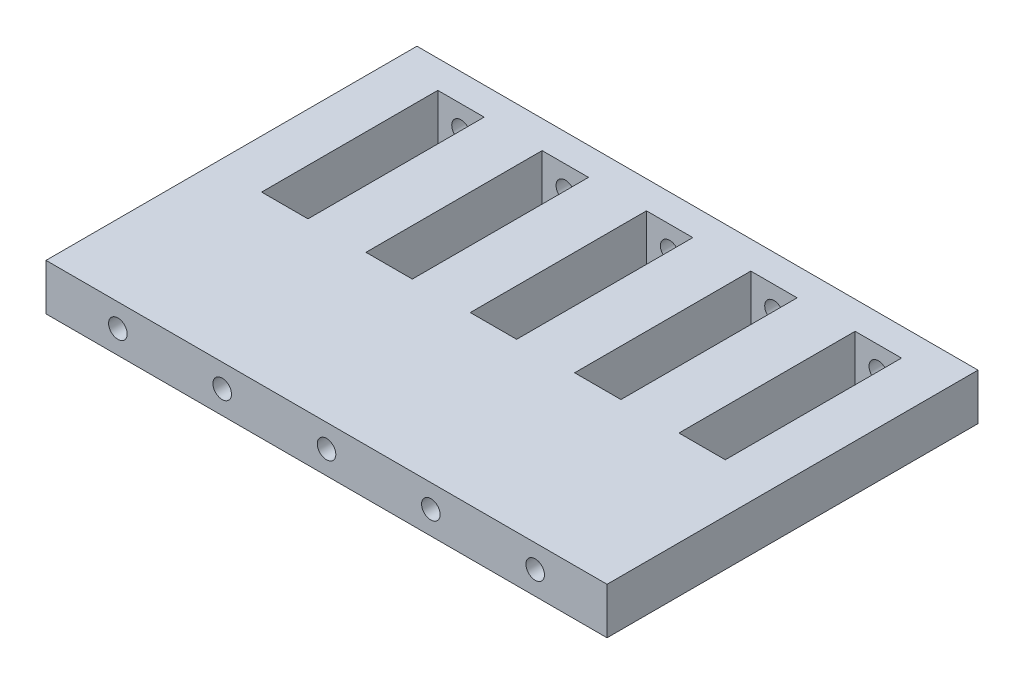
from build123d import *

# Parameters (mm, degrees)
SKETCH1_W           = 121
SKETCH1_H           = 80
BOSS_EXTRUDE1_DEPTH = 10
SKETCH2_W           = 10
SKETCH2_H           = 68
CUT_EXTRUDE1_DEPTH  = 10
SKETCH7_R           = 2
CUT_EXTRUDE4_DEPTH  = 108.099253032
SKETCH8_W           = 100
SKETCH8_H           = 30
BOSS_EXTRUDE4_DEPTH = 10


with BuildPart() as part:
    # Sketch1 → Boss-Extrude1 (new body)
    with BuildSketch(Plane(origin=(0, 0, 0), x_dir=(1, 0, 0), z_dir=(0, 1, 0))):
        with Locations((10, 40)):
            Rectangle(SKETCH1_W, SKETCH1_H)
    extrude(amount=BOSS_EXTRUDE1_DEPTH)

    # Sketch2 → Cut-Extrude1 (cut)
    with BuildSketch(Plane(origin=(0, 10, 0), x_dir=(1, 0, 0), z_dir=(0, 1, 0))):
        with Locations((-35, 40)):
            Rectangle(SKETCH2_W, SKETCH2_H)
        with Locations((-12.5, 40)):
            Rectangle(SKETCH2_W, SKETCH2_H)
        with Locations((10, 40)):
            Rectangle(SKETCH2_W, SKETCH2_H)
        with Locations((32.5, 40)):
            Rectangle(SKETCH2_W, SKETCH2_H)
        with Locations((55, 40)):
            Rectangle(SKETCH2_W, SKETCH2_H)
    extrude(amount=-CUT_EXTRUDE1_DEPTH, mode=Mode.SUBTRACT)

    # Sketch7 → Cut-Extrude4 (cut, through all)
    with BuildSketch(Plane.XY):
        with Locations((-35, 5)):
            Circle(SKETCH7_R)
        with Locations((-12.5, 5)):
            Circle(SKETCH7_R)
        with Locations((10, 5)):
            Circle(SKETCH7_R)
        with Locations((32.5, 5)):
            Circle(SKETCH7_R)
        with Locations((55, 5)):
            Circle(SKETCH7_R)
    extrude(amount=-CUT_EXTRUDE4_DEPTH, mode=Mode.SUBTRACT)

    # Sketch8 → Boss-Extrude4 (add)
    with BuildSketch(Plane(origin=(0, 10, 0), x_dir=(1, 0, 0), z_dir=(0, 1, 0))):
        with Locations((10, 21)):
            Rectangle(SKETCH8_W, SKETCH8_H)
    extrude(amount=-BOSS_EXTRUDE4_DEPTH)


solid = part.part
